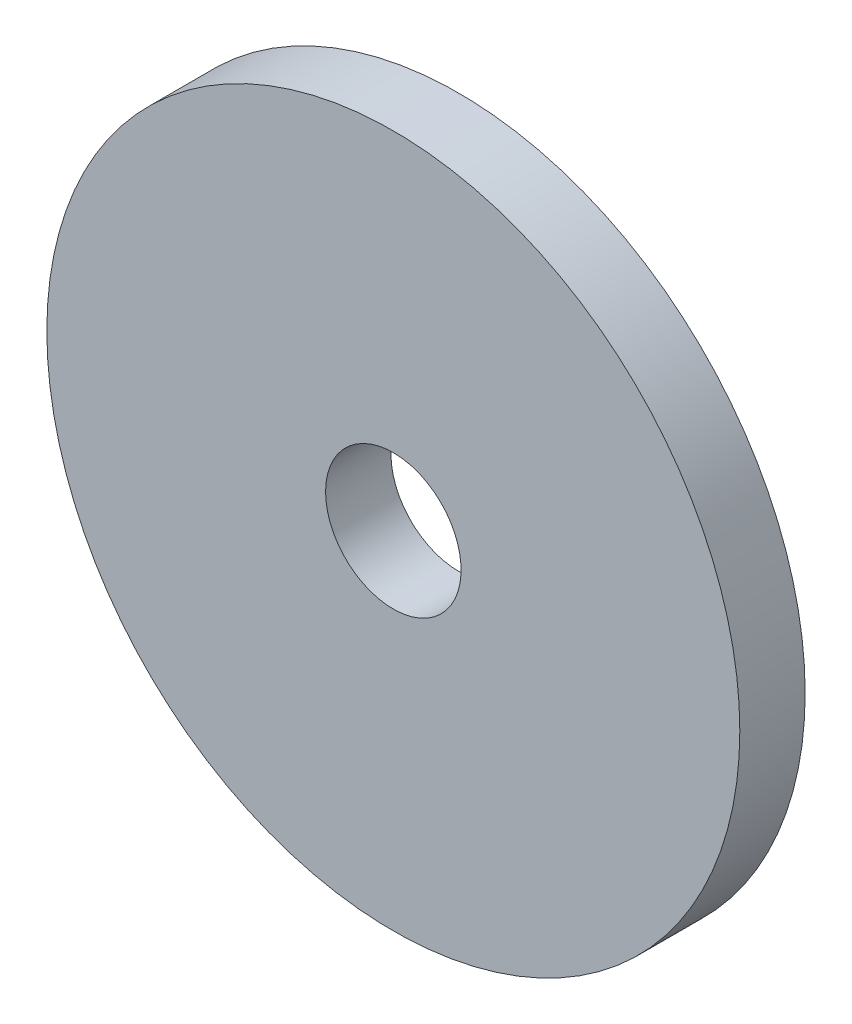
from build123d import *

# Parameters (mm, degrees)
BASEPLATE_R         = 101
BASEPLATE_R_2       = 19.747025761
BOSS_EXTRUDE1_DEPTH = 19.05


with BuildPart() as part:
    # Baseplate → Boss-Extrude1 (new body)
    with BuildSketch(Plane.XY):
        with Locations(Location((0, 0, 0), (0, 0, 180))):
            Circle(BASEPLATE_R)
        with Locations(Location((0, 0, 0), (0, 0, 180))):
            Circle(BASEPLATE_R_2, mode=Mode.SUBTRACT)
    extrude(amount=BOSS_EXTRUDE1_DEPTH)


solid = part.part
